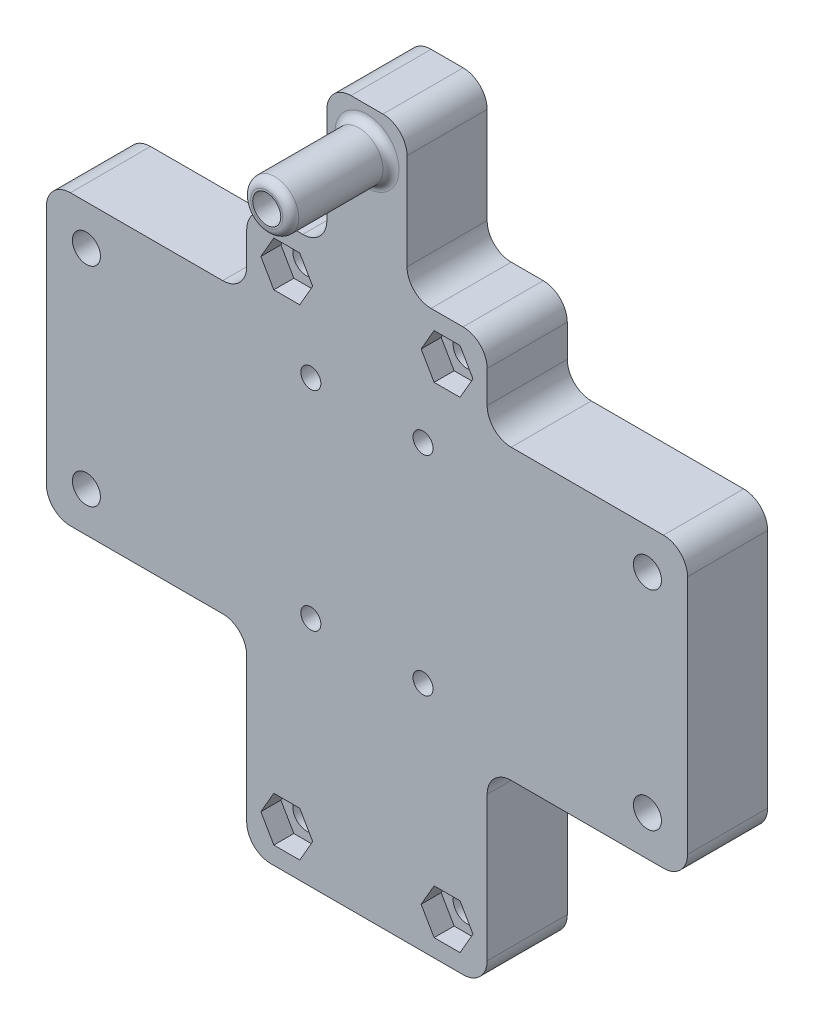
from build123d import *

# Parameters (mm, degrees)
SKETCH_2_W          = 25
SKETCH_2_H          = 25
SKETCH_2_R          = 1.75
SKETCH_2_H_2        = 11
SKETCH_2_W_2        = 30
SKETCH_2_R_2        = 1.25
SKETCH_2_H_3        = 24
SKETCH_2_W_3        = 10
SKETCH_2_H_4        = 10
SKETCH_2_H_5        = 18
EXTRUDE_1_DEPTH     = 10
SKETCH_4_R          = 3.2
CUT_EXTRUDE_2_DEPTH = 2.5
SKETCH_5_R          = 2.2
CUT_EXTRUDE_3_DEPTH = 2
FILLET_2_R          = 3
CUT_EXTRUDE_4_DEPTH = 2.5
CUT_EXTRUDE_5_DEPTH = 2.5
SKETCH_8_R          = 3
SKETCH_8_R_2        = 1.75
EXTRUDE_2_DEPTH     = 12.5
FILLET_3_R          = 1


with BuildPart() as part:
    # ｽｹｯﾁ2 → ﾎﾞｽ - 押し出し1 (new body)
    # profile 1 of 11: a face of its own
    with BuildSketch(Plane.XY):
        with Locations((-27.5, 5.5)):
            Rectangle(SKETCH_2_W, SKETCH_2_H)
        with Locations((-35, 13)):
            Circle(SKETCH_2_R, mode=Mode.SUBTRACT)
    # profile 2 of 11: a face of its own
    with BuildSketch(Plane.XY):
        with Locations((-27.5, -12.5)):
            Rectangle(SKETCH_2_W, SKETCH_2_H_2)
        with Locations((-35, -13)):
            Circle(SKETCH_2_R, mode=Mode.SUBTRACT)
    # profile 3 of 11: a face of its own
    with BuildSketch(Plane.XY):
        with Locations((0, -12.5)):
            Rectangle(SKETCH_2_W_2, SKETCH_2_H_2)
        with Locations((-7, -13)):
            Circle(SKETCH_2_R_2, mode=Mode.SUBTRACT)
        with Locations((7, -13)):
            Circle(SKETCH_2_R_2, mode=Mode.SUBTRACT)
    # profile 4 of 11: a face of its own
    with BuildSketch(Plane.XY):
        Polygon((15, 18), (5, 18), (-5, 18), (-15, 18), (-15, -7), (15, -7), align=None)
        with Locations((-7, 13)):
            Circle(SKETCH_2_R_2, mode=Mode.SUBTRACT)
        with Locations((7, 13)):
            Circle(SKETCH_2_R_2, mode=Mode.SUBTRACT)
    # profile 5 of 11: a face of its own
    with BuildSketch(Plane.XY):
        with Locations((27.5, 5.5)):
            Rectangle(SKETCH_2_W, SKETCH_2_H)
        with Locations((35, 13)):
            Circle(SKETCH_2_R, mode=Mode.SUBTRACT)
    # profile 6 of 11: a face of its own
    with BuildSketch(Plane.XY):
        with Locations((27.5, -12.5)):
            Rectangle(SKETCH_2_W, SKETCH_2_H_2)
        with Locations((35, -13)):
            Circle(SKETCH_2_R, mode=Mode.SUBTRACT)
    # profile 7 of 11: a face of its own
    with BuildSketch(Plane.XY):
        with Locations((0, -30)):
            Rectangle(SKETCH_2_W_2, SKETCH_2_H_3)
        with Locations((-10, -37)):
            Circle(SKETCH_2_R, mode=Mode.SUBTRACT)
        with Locations((10, -37)):
            Circle(SKETCH_2_R, mode=Mode.SUBTRACT)
    # profile 8 of 11: a face of its own
    with BuildSketch(Plane.XY):
        with Locations((-10, 23)):
            Rectangle(SKETCH_2_W_3, SKETCH_2_H_4)
        with Locations((-10, 23)):
            Circle(SKETCH_2_R, mode=Mode.SUBTRACT)
    # profile 9 of 11: a face of its own
    with BuildSketch(Plane.XY):
        with Locations((0, 23)):
            Rectangle(SKETCH_2_W_3, SKETCH_2_H_4)
    # profile 10 of 11: a face of its own
    with BuildSketch(Plane.XY):
        with Locations((10, 23)):
            Rectangle(SKETCH_2_W_3, SKETCH_2_H_4)
        with Locations((10, 23)):
            Circle(SKETCH_2_R, mode=Mode.SUBTRACT)
    # profile 11 of 11: a face of its own
    with BuildSketch(Plane.XY):
        with Locations((0, 37)):
            Rectangle(SKETCH_2_W_3, SKETCH_2_H_5)
        with Locations((0, 41)):
            Circle(SKETCH_2_R, mode=Mode.SUBTRACT)
    extrude(amount=EXTRUDE_1_DEPTH)

    # ｽｹｯﾁ4 → ｶｯﾄ - 押し出し2 (cut)
    with BuildSketch(Plane(origin=(0, 0, 0), x_dir=(-1, 0, 0), z_dir=(0, 0, -1))):
        with Locations((-35, 13)):
            Circle(SKETCH_4_R)
        with Locations(Location((35, 13, 0), (0, 0, 180))):
            Circle(SKETCH_4_R)
        with Locations((35, -13)):
            Circle(SKETCH_4_R)
        with Locations(Location((-35, -13, 0), (0, 0, 180))):
            Circle(SKETCH_4_R)
    extrude(amount=-CUT_EXTRUDE_2_DEPTH, mode=Mode.SUBTRACT)

    # ｽｹｯﾁ5 → ｶｯﾄ - 押し出し3 (cut)
    with BuildSketch(Plane(origin=(0, 0, 0), x_dir=(-1, 0, 0), z_dir=(0, 0, -1))):
        with Locations((-7, 13)):
            Circle(SKETCH_5_R)
        with Locations(Location((7, 13, 0), (0, 0, 180))):
            Circle(SKETCH_5_R)
        with Locations((7, -13)):
            Circle(SKETCH_5_R)
        with Locations(Location((-7, -13, 0), (0, 0, 180))):
            Circle(SKETCH_5_R)
    extrude(amount=-CUT_EXTRUDE_3_DEPTH, mode=Mode.SUBTRACT)

    # ﾌｨﾚｯﾄ2
    fillet_2_edges = [part.edges().sort_by_distance(p)[0] for p in [
        (15, -18, 5),
        (15, -42, 5),
        (-15, -42, 5),
        (-15, -18, 5),
        (-40, -18, 5),
        (-40, 18, 5),
        (-15, 18, 5),
        (-15, 28, 5),
        (-5, 28, 5),
        (-5, 46, 5),
        (5, 46, 5),
        (5, 28, 5),
        (15, 28, 5),
        (15, 18, 5),
        (40, 18, 5),
        (40, -18, 5),
    ]]
    fillet(fillet_2_edges, radius=FILLET_2_R)

    # ｽｹｯﾁ6 → ｶｯﾄ - 押し出し4 (cut)
    with BuildSketch(Plane(origin=(0, 0, 0), x_dir=(-1, 0, 0), z_dir=(0, 0, -1))):
        Polygon((3.233161507, 41), (1.616580754, 43.8), (-1.616580754, 43.8), (-3.233161507, 41), (-1.616580754, 38.2), (1.616580754, 38.2), align=None)
    extrude(amount=-CUT_EXTRUDE_4_DEPTH, mode=Mode.SUBTRACT)

    # ｽｹｯﾁ7 → ｶｯﾄ - 押し出し5 (cut)
    with BuildSketch(Plane.XY.offset(10)):
        Polygon((-6.766838493, 23), (-8.383419246, 25.8), (-11.616580754, 25.8), (-13.233161507, 23), (-11.616580754, 20.2), (-8.383419246, 20.2), align=None)
        Polygon((8.383419246, 20.2), (6.766838493, 23), (8.383419246, 25.8), (11.616580754, 25.8), (13.233161507, 23), (11.616580754, 20.2), align=None)
        Polygon((8.383419246, -39.8), (6.766838493, -37), (8.383419246, -34.2), (11.616580754, -34.2), (13.233161507, -37), (11.616580754, -39.8), align=None)
        Polygon((-6.766838493, -37), (-8.383419246, -34.2), (-11.616580754, -34.2), (-13.233161507, -37), (-11.616580754, -39.8), (-8.383419246, -39.8), align=None)
    extrude(amount=-CUT_EXTRUDE_5_DEPTH, mode=Mode.SUBTRACT)

    # ｽｹｯﾁ8 → ﾎﾞｽ - 押し出し2 (add)
    with BuildSketch(Plane.XY.offset(10)):
        with Locations((0, 41)):
            Circle(SKETCH_8_R)
        with Locations(Location((0, 41, 0), (0, 0, 180))):
            Circle(SKETCH_8_R_2, mode=Mode.SUBTRACT)
    extrude(amount=EXTRUDE_2_DEPTH)

    # ﾌｨﾚｯﾄ3
    fillet_3_edges = [part.edges().sort_by_distance(p)[0] for p in [
        (-3, 41, 22.5),
        (-3, 41, 10),
    ]]
    fillet(fillet_3_edges, radius=FILLET_3_R)


solid = part.part
